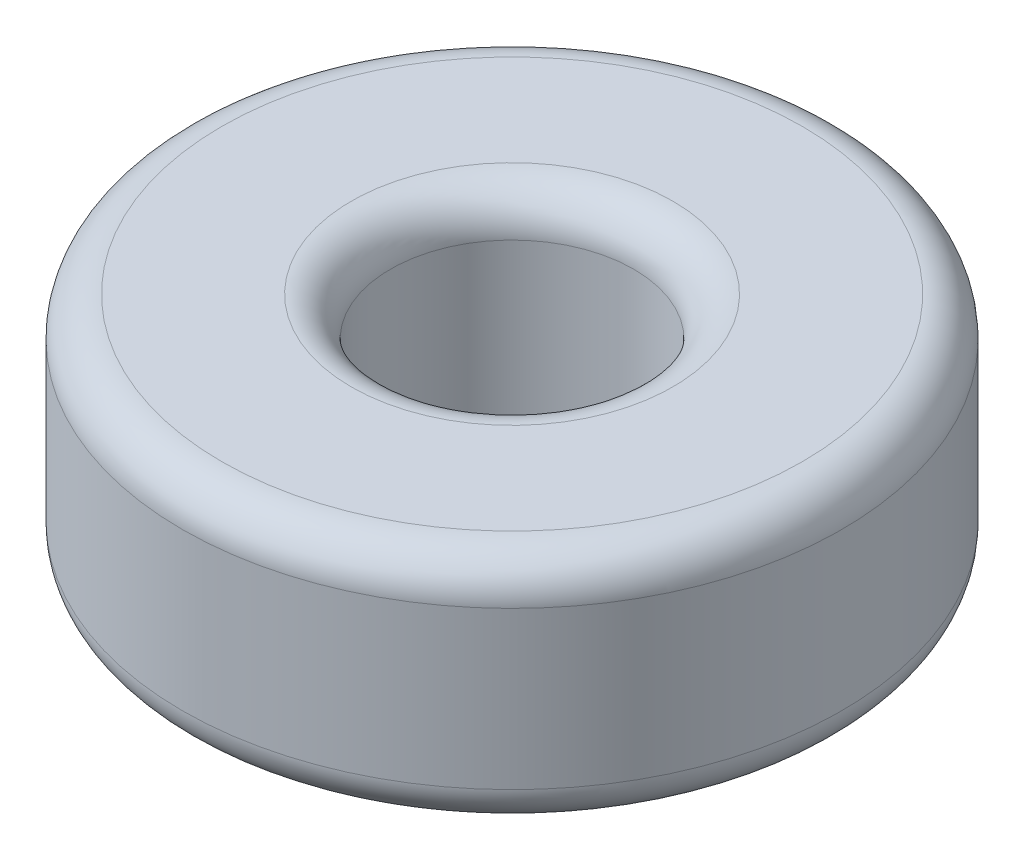
from build123d import *

# Parameters (mm, degrees)
SKETCH1_R           = 8.4
SKETCH1_R_2         = 3.1
BOSS_EXTRUDE1_DEPTH = 6
FILLET1_R           = 1


with BuildPart() as part:
    # Sketch1 → Boss-Extrude1 (new body)
    with BuildSketch(Plane(origin=(0, 0, 0), x_dir=(1, 0, 0), z_dir=(0, 1, 0))):
        with Locations(Location((0, 0, 0), (0, 0, 270))):
            Circle(SKETCH1_R)
        with Locations(Location((0, 0, 0), (0, 0, 270))):
            Circle(SKETCH1_R_2, mode=Mode.SUBTRACT)
    extrude(amount=BOSS_EXTRUDE1_DEPTH)

    # Fillet1
    fillet1_edges = [part.edges().sort_by_distance(p)[0] for p in [
        (0, 0, -8.4),
        (0, 6, -8.4),
        (0, 0, -3.1),
        (0, 6, -3.1),
    ]]
    fillet(fillet1_edges, radius=FILLET1_R)


solid = part.part
